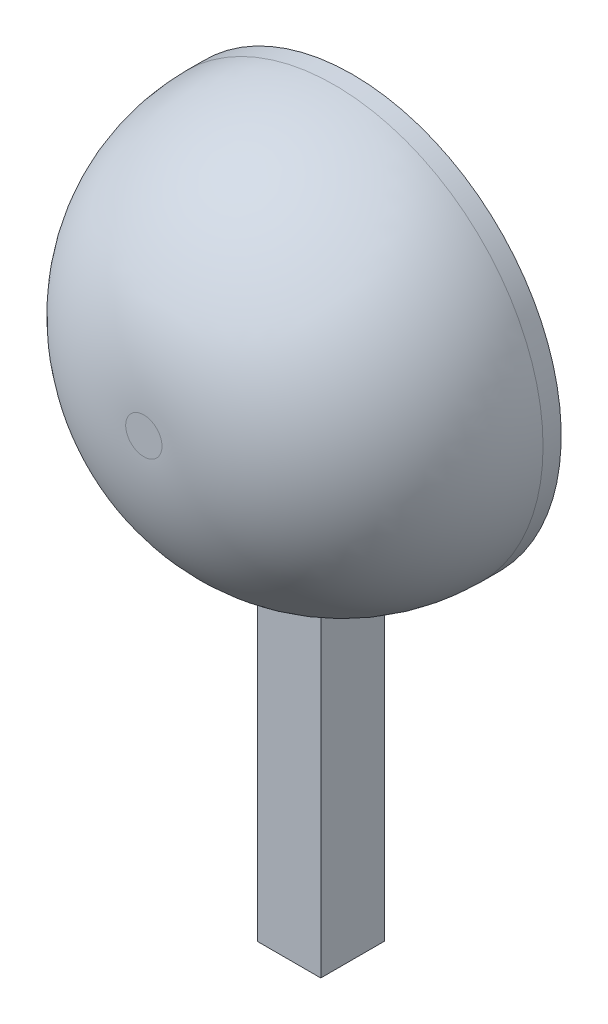
from build123d import *

# Parameters (mm, degrees)
SKETCH2_R                = 23
BOSS_EXTRUDE1_DEPTH      = 23
FILLET1_R                = 21
SHELL1_T                 = -4
FILLET2_R                = 1
BOSS_EXTRUDE3_DEPTH      = 3
BOSS_EXTRUDE3_DEPTH_BACK = 35
SKETCH5_W                = 7
SKETCH5_H                = 7


with BuildPart() as part:
    # Sketch2 → Boss-Extrude1 (new body)
    with BuildSketch(Plane.XY):
        with Locations((0, 23)):
            Circle(SKETCH2_R)
    extrude(amount=BOSS_EXTRUDE1_DEPTH)

    # Fillet1
    fillet1_edges = [part.edges().sort_by_distance(p)[0] for p in [
        (-23, 23, 23),
    ]]
    fillet(fillet1_edges, radius=FILLET1_R)

    # Shell1
    shell1_openings = [part.faces().sort_by_distance(p)[0] for p in [
        (0, 23, 0),
    ]]
    offset(amount=SHELL1_T, openings=shell1_openings, kind=Kind.INTERSECTION)

    # Fillet2
    fillet2_edges = [part.edges().sort_by_distance(p)[0] for p in [
        (-19, 23, 0),
    ]]
    fillet(fillet2_edges, radius=FILLET2_R)

    # Sketch5 → Boss-Extrude3 (add, two sides: drawn at the far end of the back side and taken through both)
    with BuildSketch(Plane(origin=(0, 0, 0), x_dir=(1, 0, 0), z_dir=(0, 1, 0)).offset(-BOSS_EXTRUDE3_DEPTH_BACK)):
        with Locations((0, -3.5)):
            Rectangle(SKETCH5_W, SKETCH5_H)
    extrude(amount=BOSS_EXTRUDE3_DEPTH + BOSS_EXTRUDE3_DEPTH_BACK)


solid = part.part
